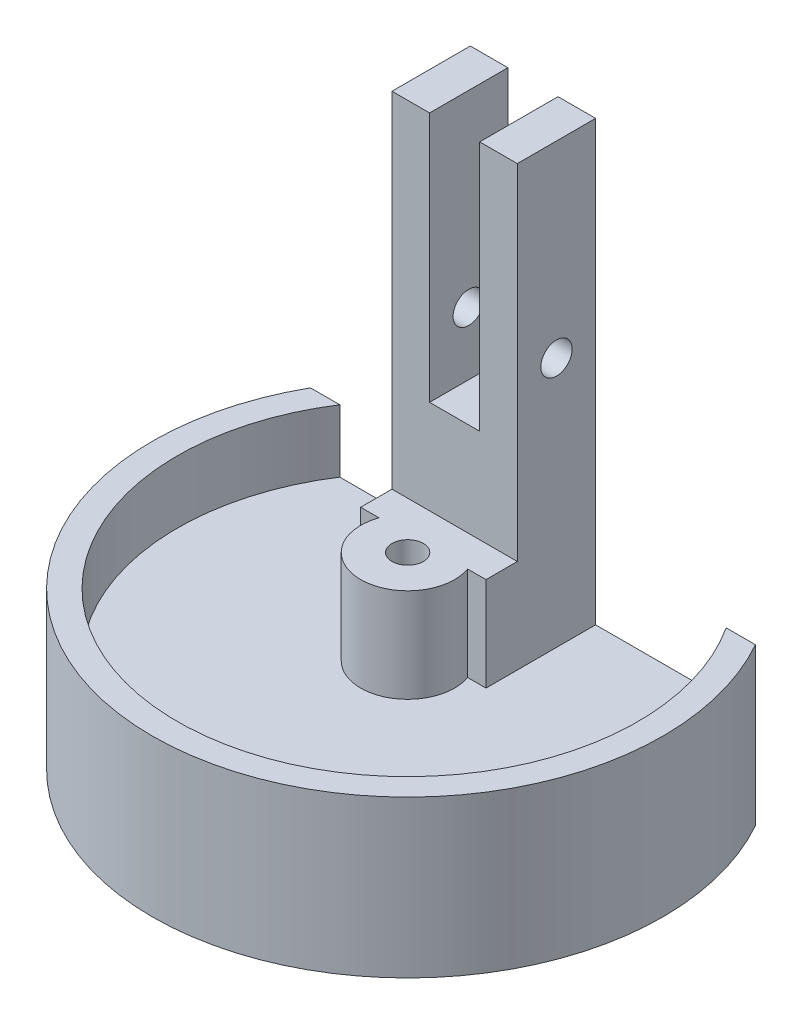
from build123d import *

# Parameters (mm, degrees)
SKETCH_1_R                      = 7.5
SKETCH_1_R_2                    = 2.5
EXTRUDE_1_DEPTH                 = 20
SKETCH_2_R                      = 40.75
SKETCH_2_R_2                    = 2.5
EXTRUDE_2_DEPTH                 = 5
EXTRUDE_T_DEPTH                 = 10
EXTRUDE_T_DEPTH_BACK            = 15
SKETCH_3_R                      = 40.75
SKETCH_3_R_2                    = 36.75
SKETCH_4_W                      = 20
SKETCH_4_H                      = 17.5
EXTRUDE_4_DEPTH                 = 70
SKETCH_6_W                      = 8
SKETCH_6_H                      = 17.5
CUT_EXTRUDE_5_DEPTH             = 40
CUT_EXTRUDE_6_REACH             = 101.303
SKETCH_7_R                      = 2.5
CUT_EXTRUDE_7_REACH             = 96.584
SKETCH_8_W                      = 71.008802272
SKETCH_8_H                      = 20.75
CUT_EXTRUDE_7_DIRECTION_2_REACH = 96.584
CUT_EXTRUDE_START               = -55
SKETCH_9_W                      = 20
SKETCH_9_H                      = 5
CUT_EXTRUDE_8_DEPTH             = 55


with BuildPart() as part:
    # Эскиз1 → Вытянуть1 (new body)
    with BuildSketch(Plane(origin=(0, 0, 0), x_dir=(1, 0, 0), z_dir=(0, 1, 0))):
        with Locations(Location((0, 0, 0), (0, 0, 270))):
            Circle(SKETCH_1_R)
        with Locations(Location((0, 0, 0), (0, 0, 270))):
            Circle(SKETCH_1_R_2, mode=Mode.SUBTRACT)
    extrude(amount=EXTRUDE_1_DEPTH)

    # Эскиз2 → Вытянуть2 (add)
    with BuildSketch(Plane(origin=(0, 0, 0), x_dir=(1, 0, 0), z_dir=(0, 1, 0))):
        with Locations(Location((0, 0, 0), (0, 0, 270))):
            Circle(SKETCH_2_R)
        with Locations(Location((0, 0, 0), (0, 0, 270))):
            Circle(SKETCH_2_R_2, mode=Mode.SUBTRACT)
    extrude(amount=EXTRUDE_2_DEPTH)

    # Эскиз3 → t (add, two sides: drawn at the far end of the back side and taken through both)
    with BuildSketch(Plane(origin=(0, 5, 0), x_dir=(1, 0, 0), z_dir=(0, 1, 0)).offset(-EXTRUDE_T_DEPTH_BACK)):
        with Locations(Location((0, 0, 0), (0, 0, 270))):
            Circle(SKETCH_3_R)
        with Locations(Location((0, 0, 0), (0, 0, 270))):
            Circle(SKETCH_3_R_2, mode=Mode.SUBTRACT)
    extrude(amount=EXTRUDE_T_DEPTH + EXTRUDE_T_DEPTH_BACK)

    # Эскиз4 → Вытянуть4 (add)
    with BuildSketch(Plane(origin=(0, 5, 0), x_dir=(1, 0, 0), z_dir=(0, 1, 0))):
        with Locations((0, 11.25)):
            Rectangle(SKETCH_4_W, SKETCH_4_H)
    extrude(amount=EXTRUDE_4_DEPTH)

    # Эскиз6 → Вытянуть5 (cut)
    with BuildSketch(Plane(origin=(0, 75, 0), x_dir=(1, 0, 0), z_dir=(0, 1, 0))):
        with Locations((0, 11.25)):
            Rectangle(SKETCH_6_W, SKETCH_6_H)
    extrude(amount=-CUT_EXTRUDE_5_DEPTH, mode=Mode.SUBTRACT)

    # Вытянуть6: up to this face of the body (flat: up to its plane)
    cut_extrude_6_end = Plane(part.part.faces().sort_by_distance((-10, 40, -11.25))[0])
    # Эскиз7 → Вытянуть6 (cut, up to the picked face)
    with BuildSketch(Plane(origin=(10, 0, 0), x_dir=(0, 0, -1), z_dir=(1, 0, 0)), mode=Mode.PRIVATE) as cut_extrude_6_sk1:
        with Locations((13.75, 45)):
            Circle(SKETCH_7_R)
    cut_extrude_6_tool1 = split(extrude(cut_extrude_6_sk1.sketch, amount=-CUT_EXTRUDE_6_REACH, mode=Mode.PRIVATE), bisect_by=cut_extrude_6_end, keep=Keep.BOTH, mode=Mode.PRIVATE)
    add(cut_extrude_6_tool1.solids().sort_by(Axis((10, 45, -13.75), (-1, 0, 0)))[0], mode=Mode.SUBTRACT)

    # Эскиз8 → Вытянуть7 (cut, up to next)
    with BuildSketch(Plane(origin=(0, 0, 0), x_dir=(1, 0, 0), z_dir=(0, 1, 0)), mode=Mode.PRIVATE) as cut_extrude_7_sk1:
        with Locations((0, 30.375)):
            Rectangle(SKETCH_8_W, SKETCH_8_H)
    cut_extrude_7_tool1 = extrude(cut_extrude_7_sk1.sketch, amount=CUT_EXTRUDE_7_REACH, mode=Mode.PRIVATE) & part.part
    add(cut_extrude_7_tool1.solids().sort_by_distance((0, 0, -30.375))[0], mode=Mode.SUBTRACT)

    # Эскиз8 → Вытянуть7 direction 2 (cut, up to next)
    with BuildSketch(Plane(origin=(0, 0, 0), x_dir=(1, 0, 0), z_dir=(0, 1, 0)), mode=Mode.PRIVATE) as cut_extrude_7_direction_2_sk1:
        with Locations((0, 30.375)):
            Rectangle(SKETCH_8_W, SKETCH_8_H)
    cut_extrude_7_direction_2_tool1 = extrude(cut_extrude_7_direction_2_sk1.sketch, amount=-CUT_EXTRUDE_7_DIRECTION_2_REACH, mode=Mode.PRIVATE) & part.part
    add(cut_extrude_7_direction_2_tool1.solids().sort_by_distance((0, 0, -30.375))[0], mode=Mode.SUBTRACT)

    # Эскиз9 → Вытянуть8 (cut)
    with BuildSketch(Plane(origin=(0, 75, 0), x_dir=(1, 0, 0), z_dir=(0, 1, 0)).offset(CUT_EXTRUDE_START)):
        with Locations((0, 5)):
            Rectangle(SKETCH_9_W, SKETCH_9_H)
    extrude(amount=CUT_EXTRUDE_8_DEPTH, mode=Mode.SUBTRACT)


solid = part.part
